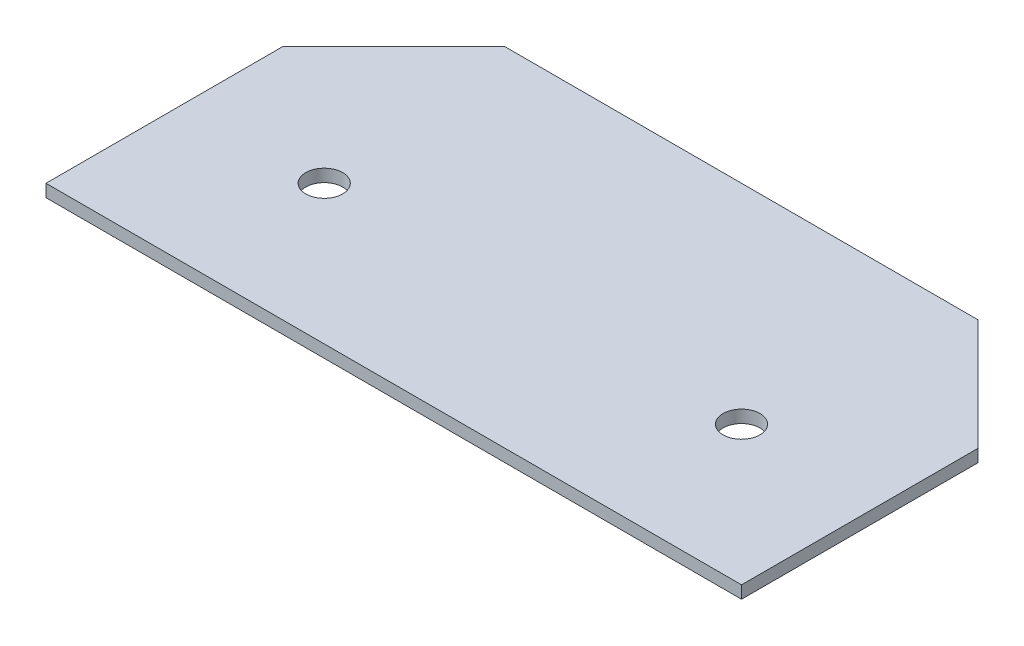
from build123d import *

# Parameters (mm, degrees)
SKETCH1_W           = 127
SKETCH1_H           = 63.5
BOSS_EXTRUDE1_DEPTH = 2.286
SKETCH2_R           = 3.3734375
CUT_EXTRUDE1_DEPTH  = 143.008717324
CHAMFER1_SIZE       = 20.32


with BuildPart() as part:
    # Sketch1 → Boss-Extrude1 (new body)
    with BuildSketch(Plane(origin=(0, 0, 0), x_dir=(1, 0, 0), z_dir=(0, 1, 0))):
        with Locations((63.5, 31.75)):
            Rectangle(SKETCH1_W, SKETCH1_H)
    extrude(amount=BOSS_EXTRUDE1_DEPTH)

    # Sketch2 → Cut-Extrude1 (cut, through all)
    with BuildSketch(Plane(origin=(0, 2.286, 0), x_dir=(1, 0, 0), z_dir=(0, 1, 0))):
        with Locations(Location((25.4, 25.4, 0), (0, 0, 270))):
            Circle(SKETCH2_R)
        with Locations(Location((101.6, 25.4, 0), (0, 0, 270))):
            Circle(SKETCH2_R)
    extrude(amount=-CUT_EXTRUDE1_DEPTH, mode=Mode.SUBTRACT)

    # Chamfer1
    chamfer1_edges = [part.edges().sort_by_distance(p)[0] for p in [
        (0, 1.143, -63.5),
        (127, 1.143, -63.5),
    ]]
    chamfer(chamfer1_edges, length=CHAMFER1_SIZE)


solid = part.part
